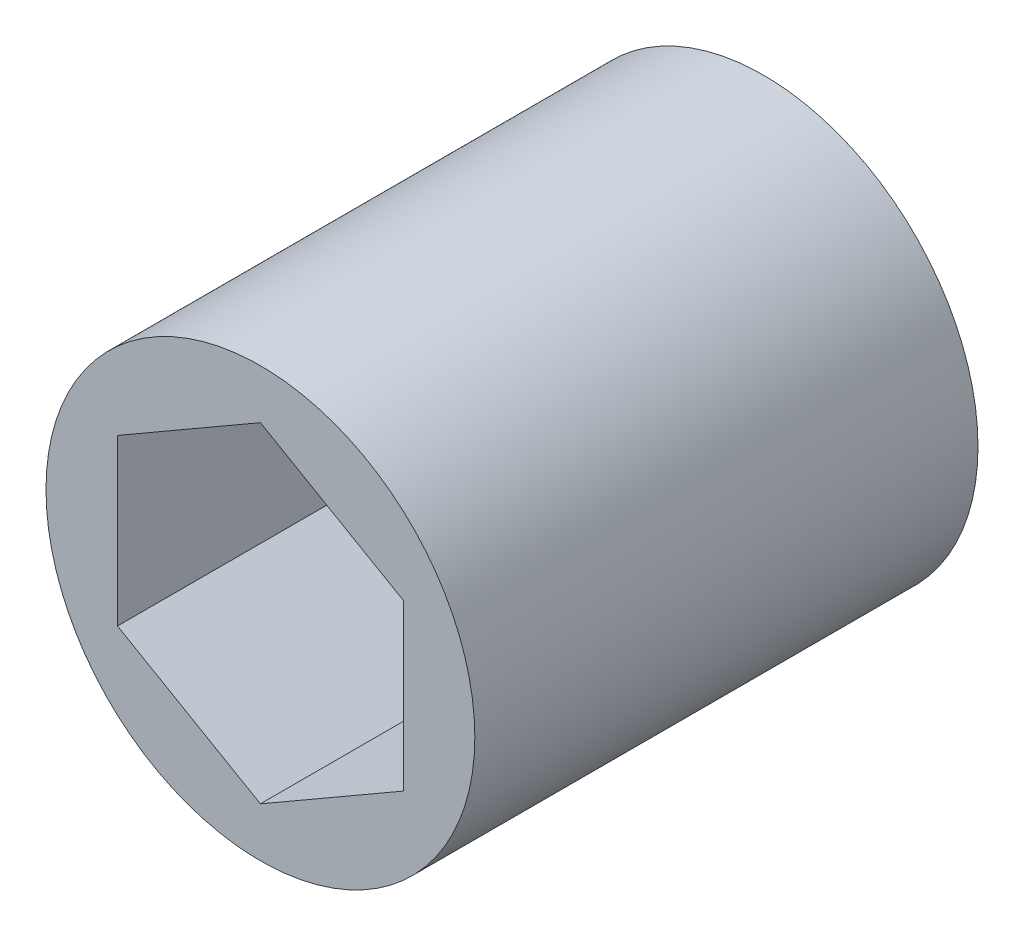
from build123d import *

# Parameters (mm, degrees)
SKETCH1_R           = 9.525
BOSS_EXTRUDE1_DEPTH = 22.352


with BuildPart() as part:
    # Sketch1 → Boss-Extrude1 (new body)
    with BuildSketch(Plane.XY):
        Circle(SKETCH1_R)
        Polygon((0, 7.332348419), (-6.35, 3.666174209), (-6.35, -3.666174209), (0, -7.332348419), (6.35, -3.666174209), (6.35, 3.666174209), align=None, mode=Mode.SUBTRACT)
    extrude(amount=BOSS_EXTRUDE1_DEPTH)


solid = part.part
